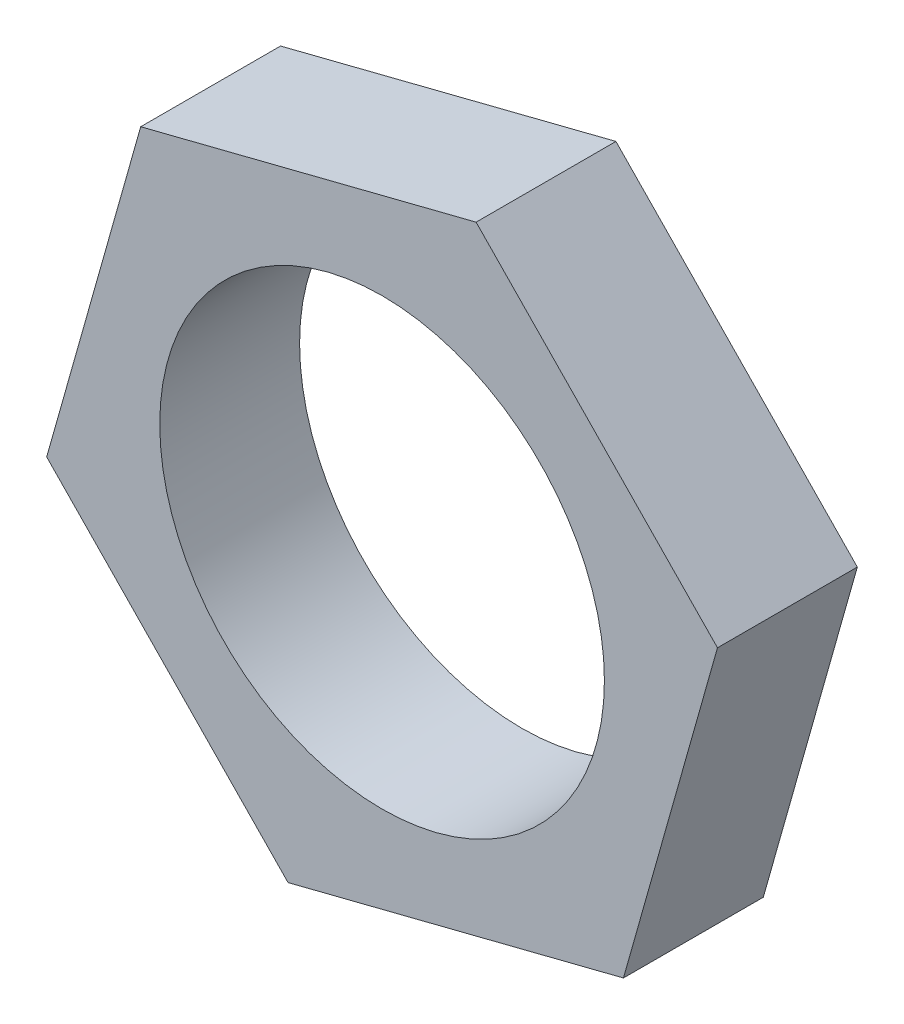
from build123d import *

# Parameters (mm, degrees)
SKETCH1_R           = 3.18
BOSS_EXTRUDE1_DEPTH = 2


with BuildPart() as part:
    # Sketch1 → Boss-Extrude1 (new body)
    with BuildSketch(Plane.XY):
        Polygon((-1.344917718, -4.76285307), (3.452292894, -3.546159445), (4.797210612, 1.216693625), (1.344917718, 4.76285307), (-3.452292894, 3.546159445), (-4.797210612, -1.216693625), align=None)
        Circle(SKETCH1_R, mode=Mode.SUBTRACT)
    extrude(amount=BOSS_EXTRUDE1_DEPTH)


solid = part.part
